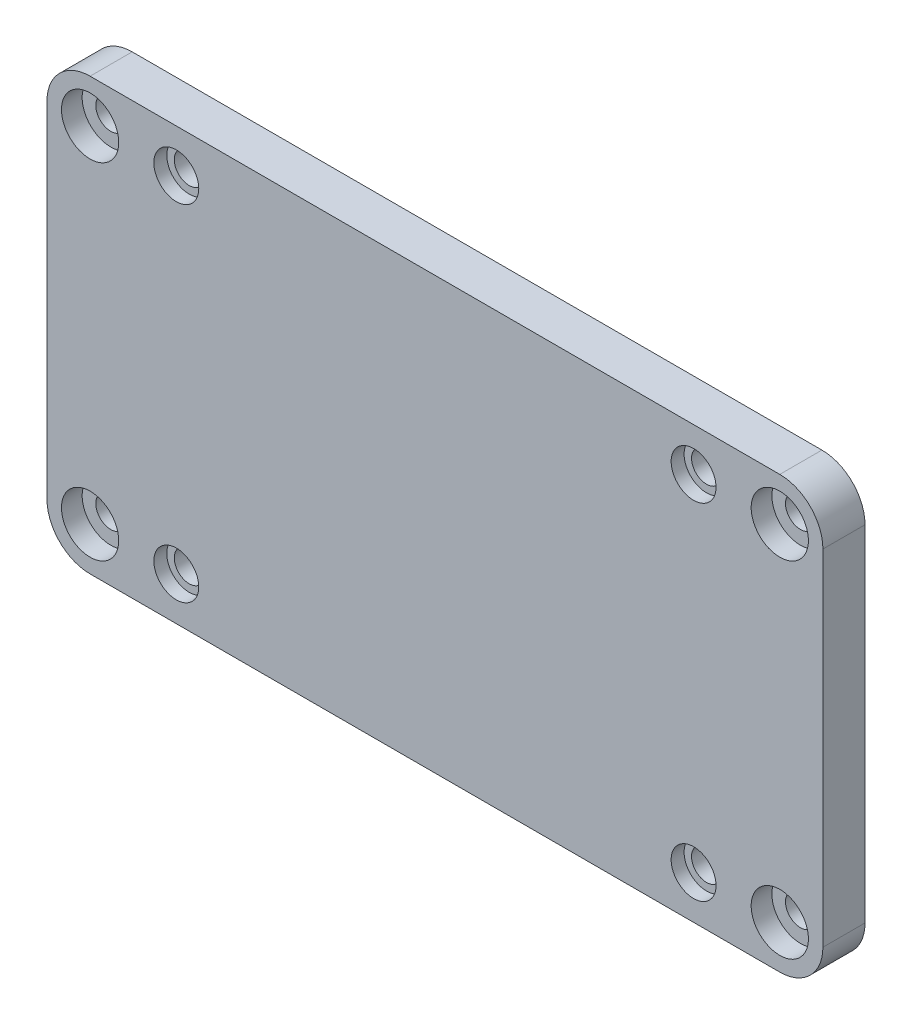
from build123d import *

# Parameters (mm, degrees)
SKETCH1_R           = 2.2098
BOSS_EXTRUDE1_DEPTH = 6.20300004
SKETCH2_R           = 4.2164
CUT_EXTRUDE1_DEPTH  = 3.048
SKETCH3_R           = 2.2098
CUT_EXTRUDE2_DEPTH  = 66.670862713
SKETCH4_R           = 3.30699999
CUT_EXTRUDE3_DEPTH  = 1.906999996


with BuildPart() as part:
    # Sketch1 → Boss-Extrude1 (new body)
    with BuildSketch(Plane.XY):
        with BuildLine():
            Line((-50.8, -31.75), (50.8, -31.75))
            ThreePointArc((50.8, -31.75), (55.290128061, -29.890128061), (57.15, -25.4))
            Line((57.15, -25.4), (57.15, 25.4))
            ThreePointArc((57.15, 25.4), (55.290128061, 29.890128061), (50.8, 31.75))
            Line((50.8, 31.75), (-50.8, 31.75))
            ThreePointArc((-50.8, 31.75), (-55.290128061, 29.890128061), (-57.15, 25.4))
            Line((-57.15, 25.4), (-57.15, -25.4))
            ThreePointArc((-57.15, -25.4), (-55.290128061, -29.890128061), (-50.8, -31.75))
        make_face()
        with Locations((-50.8, -25.4)):
            Circle(SKETCH1_R, mode=Mode.SUBTRACT)
        with Locations((-50.8, 25.4)):
            Circle(SKETCH1_R, mode=Mode.SUBTRACT)
        with Locations((50.8, 25.4)):
            Circle(SKETCH1_R, mode=Mode.SUBTRACT)
        with Locations((50.8, -25.4)):
            Circle(SKETCH1_R, mode=Mode.SUBTRACT)
    extrude(amount=BOSS_EXTRUDE1_DEPTH)

    # Sketch2 → Cut-Extrude1 (cut)
    with BuildSketch(Plane.XY.offset(6.20300004)):
        with Locations((-50.8, 25.4)):
            Circle(SKETCH2_R)
        with Locations((50.8, 25.4)):
            Circle(SKETCH2_R)
        with Locations((50.8, -25.4)):
            Circle(SKETCH2_R)
        with Locations((-50.8, -25.4)):
            Circle(SKETCH2_R)
    extrude(amount=-CUT_EXTRUDE1_DEPTH, mode=Mode.SUBTRACT)

    # Sketch3 → Cut-Extrude2 (cut, through all)
    with BuildSketch(Plane.XY.offset(6.20300004)):
        with Locations((-38.1, 25.4)):
            Circle(SKETCH3_R)
        with Locations(Location((38.1, 25.4, 0), (0, 0, 180))):
            Circle(SKETCH3_R)
        with Locations((38.1, -25.4)):
            Circle(SKETCH3_R)
        with Locations(Location((-38.1, -25.4, 0), (0, 0, 180))):
            Circle(SKETCH3_R)
    extrude(amount=-CUT_EXTRUDE2_DEPTH, mode=Mode.SUBTRACT)

    # Sketch4 → Cut-Extrude3 (cut)
    with BuildSketch(Plane.XY.offset(6.20300004)):
        with Locations((-38.1, 25.4)):
            Circle(SKETCH4_R)
        with Locations((38.1, 25.4)):
            Circle(SKETCH4_R)
        with Locations((38.1, -25.4)):
            Circle(SKETCH4_R)
        with Locations((-38.1, -25.4)):
            Circle(SKETCH4_R)
    extrude(amount=-CUT_EXTRUDE3_DEPTH, mode=Mode.SUBTRACT)


solid = part.part
